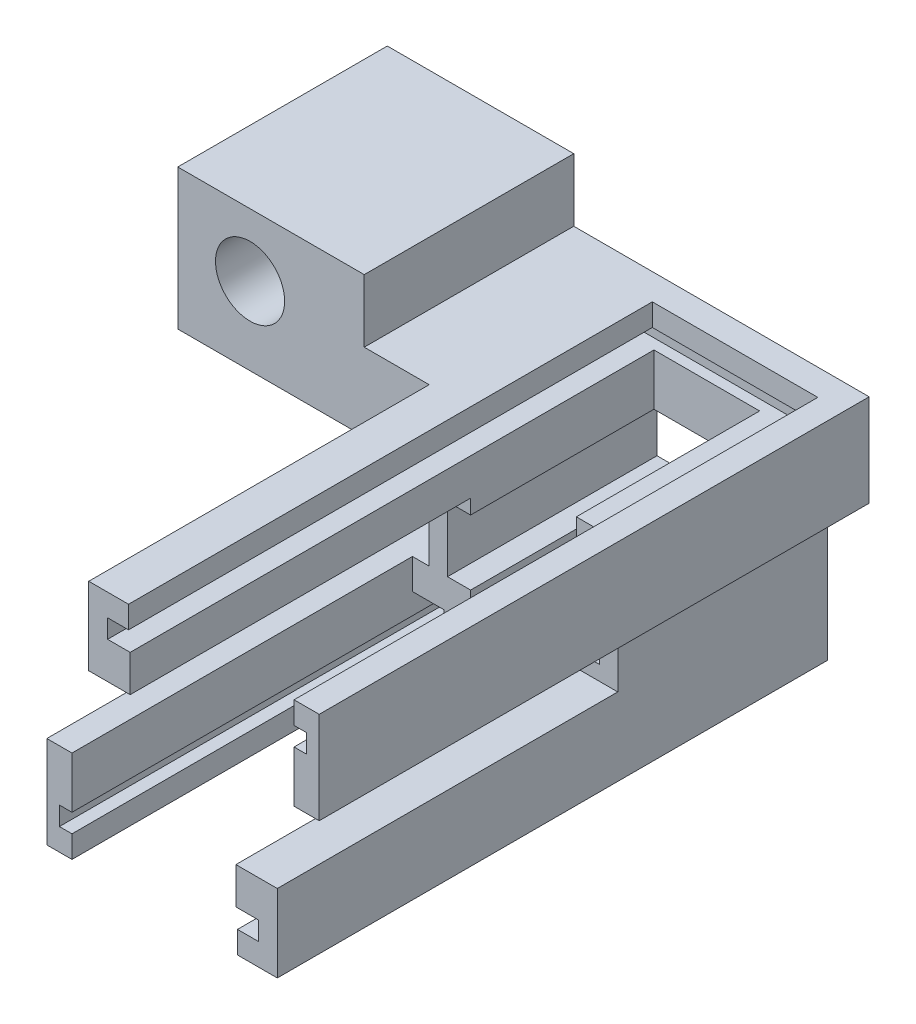
from build123d import *

# Parameters (mm, degrees)
SKETCH2_W            = 26
SKETCH2_H            = 23.8
BOSS_EXTRUDE1_DEPTH  = 20
SKETCH3_W            = 14.5
SKETCH3_H            = 6.2
CUT_EXTRUDE1_DEPTH   = 20
SKETCH4_W            = 10.09
SKETCH4_H            = 4.9
CUT_EXTRUDE2_DEPTH   = 17.5
SKETCH5_W            = 10.09
SKETCH5_H            = 4.9
CUT_EXTRUDE3_DEPTH   = 17.5
SKETCH10_W           = 3
SKETCH10_H           = 2
CUT_EXTRUDE4_DEPTH   = 17.5
SKETCH11_W           = 3
SKETCH11_H           = 2
CUT_EXTRUDE5_DEPTH   = 17.5
SKETCH7_W            = 19
SKETCH7_H            = 1.78
CUT_EXTRUDE6_DEPTH   = 18.5
SKETCH6_W            = 19
SKETCH6_H            = 1.78
CUT_EXTRUDE7_DEPTH   = 18.5
SKETCH9_W            = 15.8
SKETCH9_H            = 2.12
CUT_EXTRUDE8_DEPTH   = 17.5
SKETCH12_W           = 15.8
SKETCH12_H           = 2.12
CUT_EXTRUDE9_DEPTH   = 17.5
SKETCH14_W           = 7.8
SKETCH14_H           = 20
BOSS_EXTRUDE2_DEPTH  = 6
SKETCH13_W           = 20
SKETCH13_H           = 12
BOSS_EXTRUDE3_DEPTH  = 20
SKETCH15_R           = 3.3
CUT_EXTRUDE10_DEPTH  = 19
SKETCH16_W           = 4
SKETCH16_H           = 15
CUT_EXTRUDE11_DEPTH  = 20
SKETCH18_W           = 4
SKETCH18_H           = 9
CUT_EXTRUDE12_DEPTH  = 20
BOSS_EXTRUDE8_DEPTH  = 32.5
BOSS_EXTRUDE9_DEPTH  = 32.5
SKETCH23_W           = 10
SKETCH23_H           = 20
CUT_EXTRUDE14_DEPTH  = 6
SKETCH24_W           = 24
SKETCH24_H           = 20
BOSS_EXTRUDE10_DEPTH = 1.4
SKETCH26_R           = 1.45
CUT_EXTRUDE15_DEPTH  = 10


with BuildPart() as part:
    # Sketch2 → Boss-Extrude1 (new body)
    with BuildSketch(Plane.XY):
        Rectangle(SKETCH2_W, SKETCH2_H)
    extrude(amount=BOSS_EXTRUDE1_DEPTH)

    # Sketch3 → Cut-Extrude1 (cut)
    with BuildSketch(Plane.XY.offset(20)):
        Rectangle(SKETCH3_W, SKETCH3_H)
    extrude(amount=-CUT_EXTRUDE1_DEPTH, mode=Mode.SUBTRACT)

    # Sketch4 → Cut-Extrude2 (cut)
    with BuildSketch(Plane.XY.offset(20)):
        with Locations((0, 5.55)):
            Rectangle(SKETCH4_W, SKETCH4_H)
    extrude(amount=-CUT_EXTRUDE2_DEPTH, mode=Mode.SUBTRACT)

    # Sketch5 → Cut-Extrude3 (cut)
    with BuildSketch(Plane.XY.offset(20)):
        with Locations((0, -5.55)):
            Rectangle(SKETCH5_W, SKETCH5_H)
    extrude(amount=-CUT_EXTRUDE3_DEPTH, mode=Mode.SUBTRACT)

    # Sketch10 → Cut-Extrude4 (cut)
    with BuildSketch(Plane.XY.offset(20)):
        with Locations((9.1, 7)):
            Rectangle(SKETCH10_W, SKETCH10_H)
    extrude(amount=-CUT_EXTRUDE4_DEPTH, mode=Mode.SUBTRACT)

    # Sketch11 → Cut-Extrude5 (cut)
    with BuildSketch(Plane.XY.offset(20)):
        with Locations((-9.1, -7)):
            Rectangle(SKETCH11_W, SKETCH11_H)
    extrude(amount=-CUT_EXTRUDE5_DEPTH, mode=Mode.SUBTRACT)

    # Sketch7 → Cut-Extrude6 (cut)
    with BuildSketch(Plane.XY.offset(20)):
        with Locations((-2.3, -8.89)):
            Rectangle(SKETCH7_W, SKETCH7_H)
    extrude(amount=-CUT_EXTRUDE6_DEPTH, mode=Mode.SUBTRACT)

    # Sketch6 → Cut-Extrude7 (cut)
    with BuildSketch(Plane.XY.offset(20)):
        with Locations((2.3, 8.89)):
            Rectangle(SKETCH6_W, SKETCH6_H)
    extrude(amount=-CUT_EXTRUDE7_DEPTH, mode=Mode.SUBTRACT)

    # Sketch9 → Cut-Extrude8 (cut)
    with BuildSketch(Plane.XY.offset(20)):
        with Locations((2.7, 10.84)):
            Rectangle(SKETCH9_W, SKETCH9_H)
    extrude(amount=-CUT_EXTRUDE8_DEPTH, mode=Mode.SUBTRACT)

    # Sketch12 → Cut-Extrude9 (cut)
    with BuildSketch(Plane.XY.offset(20)):
        with Locations((-2.7, -10.84)):
            Rectangle(SKETCH12_W, SKETCH12_H)
    extrude(amount=-CUT_EXTRUDE9_DEPTH, mode=Mode.SUBTRACT)

    # Sketch14 → Boss-Extrude2 (add)
    with BuildSketch(Plane(origin=(0, 11.9, 0), x_dir=(1, 0, 0), z_dir=(0, 1, 0))):
        with Locations((-9.1, -10)):
            Rectangle(SKETCH14_W, SKETCH14_H)
    extrude(amount=BOSS_EXTRUDE2_DEPTH)

    # Sketch13 → Boss-Extrude3 (add)
    with BuildSketch(Plane.ZY.offset(13)):
        with Locations((10, 11.9)):
            Rectangle(SKETCH13_W, SKETCH13_H)
    extrude(amount=BOSS_EXTRUDE3_DEPTH)

    # Sketch15 → Cut-Extrude10 (cut)
    with BuildSketch(Plane.XY.offset(20)):
        with Locations((-26.1, 11.9)):
            Circle(SKETCH15_R)
    extrude(amount=-CUT_EXTRUDE10_DEPTH, mode=Mode.SUBTRACT)

    # Sketch16 → Cut-Extrude11 (cut)
    with BuildSketch(Plane.XY.offset(20)):
        with Locations((11, -4.4)):
            Rectangle(SKETCH16_W, SKETCH16_H)
    extrude(amount=-CUT_EXTRUDE11_DEPTH, mode=Mode.SUBTRACT)

    # Sketch18 → Cut-Extrude12 (cut)
    with BuildSketch(Plane.XY.offset(20)):
        with Locations((-11, 1.4)):
            Rectangle(SKETCH18_W, SKETCH18_H)
    extrude(amount=-CUT_EXTRUDE12_DEPTH, mode=Mode.SUBTRACT)

    # Sketch21 → Boss-Extrude8 (add)
    with BuildSketch(Plane.XY.offset(20)):
        Polygon((-13, -11.9), (-13, -3.1), (-10.6, -3.1), (-10.6, -8), (-11.8, -8), (-11.8, -9.78), (-10.6, -9.78), (-10.6, -11.9), align=None)
        Polygon((5.2, -9.78), (5.2, -11.9), (9, -11.9), (9, -4.5), (5.045, -4.5), (5.045, -8), (7.2, -8), (7.2, -9.78), align=None)
    extrude(amount=BOSS_EXTRUDE8_DEPTH)

    # Sketch22 → Boss-Extrude9 (add)
    with BuildSketch(Plane.XY.offset(20)):
        Polygon((10.6, 11.9), (13, 11.9), (13, 3.1), (10.6, 3.1), (10.6, 8), (11.8, 8), (11.8, 9.78), (10.6, 9.78), align=None)
        Polygon((-5.2, 9.78), (-5.2, 11.9), (-9, 11.9), (-9, 4.5), (-5.045, 4.5), (-5.045, 8), (-7.2, 8), (-7.2, 9.78), align=None)
    extrude(amount=BOSS_EXTRUDE9_DEPTH)

    # Sketch23 → Cut-Extrude14 (cut)
    with BuildSketch(Plane(origin=(0, 17.9, 0), x_dir=(1, 0, 0), z_dir=(0, 1, 0))):
        with Locations((-10.2, -10)):
            Rectangle(SKETCH23_W, SKETCH23_H)
    extrude(amount=-CUT_EXTRUDE14_DEPTH, mode=Mode.SUBTRACT)

    # Sketch24 → Boss-Extrude10 (add)
    with BuildSketch(Plane.XZ.offset(-5.9)):
        with Locations((-21, 10)):
            Rectangle(SKETCH24_W, SKETCH24_H)
    extrude(amount=BOSS_EXTRUDE10_DEPTH)

    # Sketch26 → Cut-Extrude15 (cut)
    with BuildSketch(Plane(origin=(0, 0, 0), x_dir=(-1, 0, 0), z_dir=(0, 0, -1))):
        with Locations((26.1, 11.9)):
            Circle(SKETCH26_R)
    extrude(amount=-CUT_EXTRUDE15_DEPTH, mode=Mode.SUBTRACT)


solid = part.part
